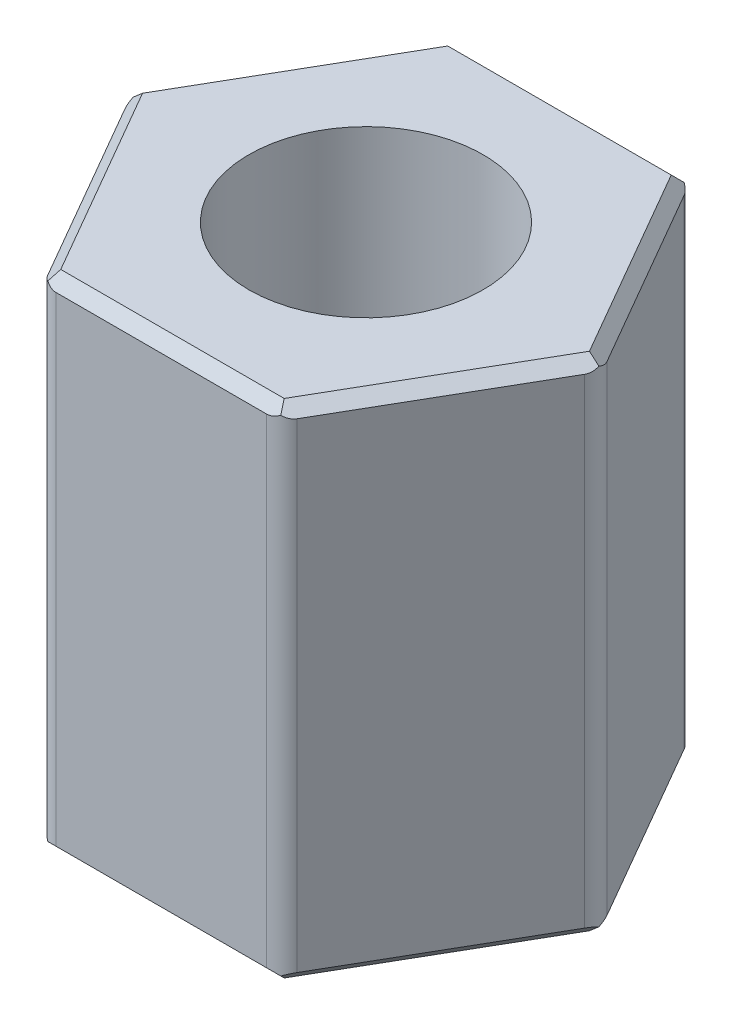
from build123d import *

# Parameters (mm, degrees)
SKETCH1_R           = 2.667
BOSS_EXTRUDE1_DEPTH = 11.43
CHAMFER1_SIZE       = 0.254
FILLET1_R           = 0.508


with BuildPart() as part:
    # Sketch1 → Boss-Extrude1 (new body)
    with BuildSketch(Plane(origin=(0, 0, 0), x_dir=(1, 0, 0), z_dir=(0, 1, 0))):
        Polygon((2.69097187, -4.6609), (5.381943739, 0), (2.69097187, 4.6609), (-2.69097187, 4.6609), (-5.381943739, 0), (-2.69097187, -4.6609), align=None)
        with Locations(Location((0, 0, 0), (0, 0, 270))):
            Circle(SKETCH1_R, mode=Mode.SUBTRACT)
    extrude(amount=BOSS_EXTRUDE1_DEPTH)

    # Chamfer1
    chamfer1_edges = [part.edges().sort_by_distance(p)[0] for p in [
        (4.036457804, 11.43, -2.33045),
        (0, 11.43, -4.6609),
        (-4.036457804, 11.43, -2.33045),
        (-4.036457804, 11.43, 2.33045),
        (0, 11.43, 4.6609),
        (-4.036457804, 0, 2.33045),
        (-4.036457804, 0, -2.33045),
        (0, 0, -4.6609),
        (4.036457804, 0, -2.33045),
        (4.036457804, 0, 2.33045),
        (0, 0, 4.6609),
        (4.036457804, 11.43, 2.33045),
    ]]
    chamfer(chamfer1_edges, length=CHAMFER1_SIZE)

    # Fillet1
    fillet1_edges = [part.edges().sort_by_distance(p)[0] for p in [
        (5.381943739, 5.715, 0),
        (2.69097187, 5.715, 4.6609),
        (2.69097187, 5.715, -4.6609),
        (-2.69097187, 5.715, -4.6609),
        (-5.381943739, 5.715, 0),
        (-2.69097187, 5.715, 4.6609),
    ]]
    fillet(fillet1_edges, radius=FILLET1_R)


solid = part.part
